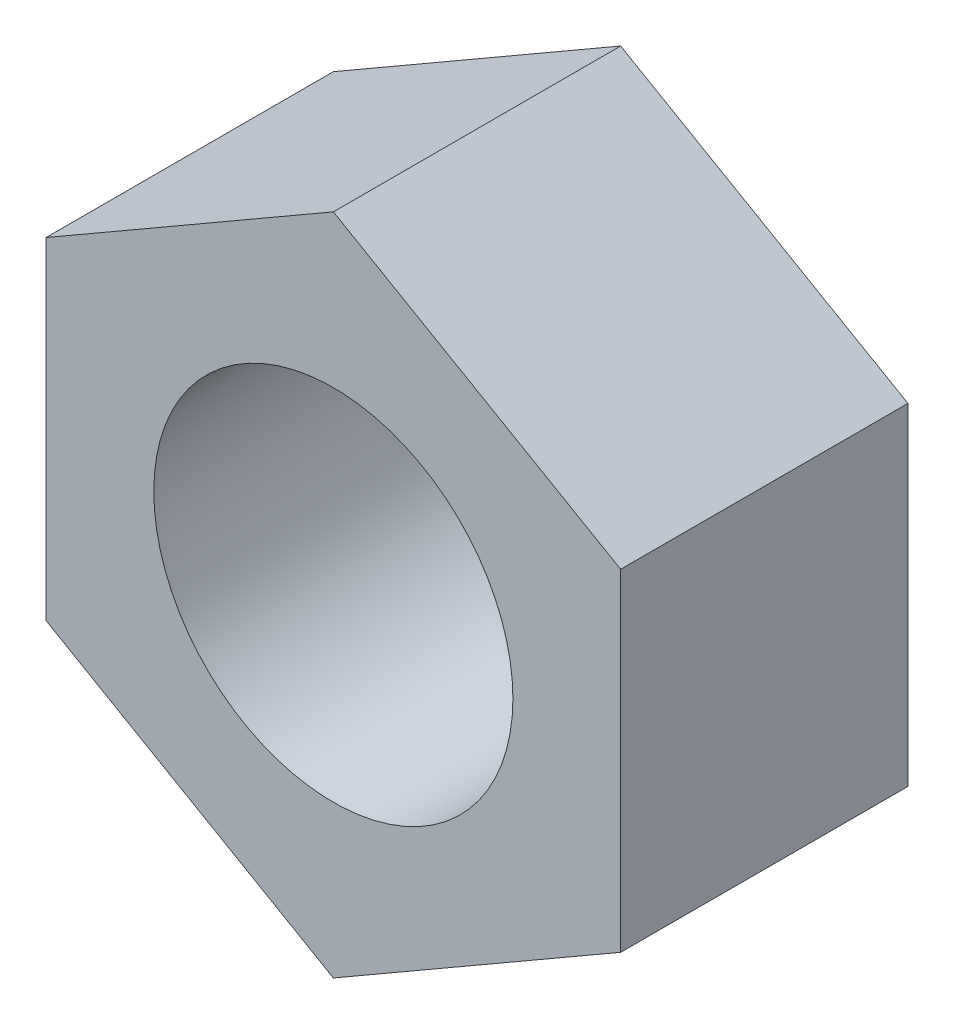
from build123d import *

# Parameters (mm, degrees)
SKICA1_R                = 1.5
P_IDAT_VYSUNUT_M1_DEPTH = 2.4


with BuildPart() as part:
    # Skica1 → Přidat vysunutím1 (new body)
    with BuildSketch(Plane.XY):
        Polygon((0, -2.771281292), (2.4, -1.385640646), (2.4, 1.385640646), (0, 2.771281292), (-2.4, 1.385640646), (-2.4, -1.385640646), align=None)
        Circle(SKICA1_R, mode=Mode.SUBTRACT)
    extrude(amount=P_IDAT_VYSUNUT_M1_DEPTH)


solid = part.part
